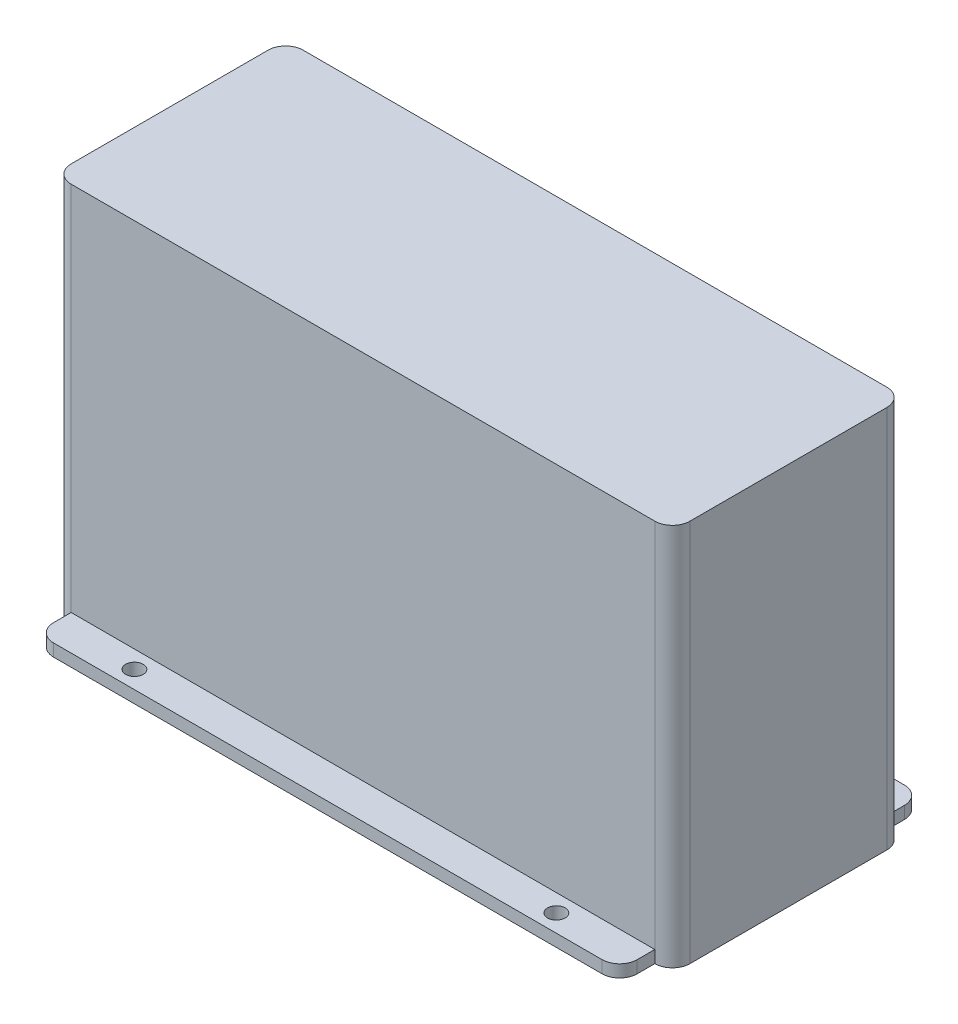
from build123d import *

# Parameters (mm, degrees)
BOSS_EXTRUDE1_DEPTH = 106
BOSS_EXTRUDE2_DEPTH = 3
SKETCH3_R           = 2.5
BOSS_EXTRUDE3_DEPTH = 3.5
CUT_EXTRUDE1_DEPTH  = 16.5
FILLET1_R           = 5


with BuildPart() as part:
    # Sketch1 → Boss-Extrude1 (new body)
    with BuildSketch(Plane(origin=(0, 0, 0), x_dir=(1, 0, 0), z_dir=(0, 1, 0))):
        with BuildLine():
            Line((83, -33), (-83, -33))
            ThreePointArc((-83, -33), (-86.535533906, -31.535533906), (-88, -28))
            Line((-88, -28), (-88, 28))
            ThreePointArc((-88, 28), (-86.535533906, 31.535533906), (-83, 33))
            Line((-83, 33), (83, 33))
            ThreePointArc((83, 33), (86.535533906, 31.535533906), (88, 28))
            Line((88, 28), (88, -28))
            ThreePointArc((88, -28), (86.535533906, -31.535533906), (83, -33))
        make_face()
        with BuildLine():
            Line((80, -30), (-80, -30))
            ThreePointArc((-80, -30), (-83.535533906, -28.535533906), (-85, -25))
            Line((-85, -25), (-85, 25))
            ThreePointArc((-85, 25), (-83.535533906, 28.535533906), (-80, 30))
            Line((-80, 30), (80, 30))
            ThreePointArc((80, 30), (83.535533906, 28.535533906), (85, 25))
            Line((85, 25), (85, -25))
            ThreePointArc((85, -25), (83.535533906, -28.535533906), (80, -30))
        make_face(mode=Mode.SUBTRACT)
    extrude(amount=BOSS_EXTRUDE1_DEPTH)

    # Sketch2 → Boss-Extrude2 (add)
    with BuildSketch(Plane(origin=(0, 106, 0), x_dir=(1, 0, 0), z_dir=(0, 1, 0))):
        with BuildLine():
            Line((-83, 33), (83, 33))
            ThreePointArc((83, 33), (86.535533906, 31.535533906), (88, 28))
            Line((88, 28), (88, -28))
            ThreePointArc((88, -28), (86.535533906, -31.535533906), (83, -33))
            Line((83, -33), (-83, -33))
            ThreePointArc((-83, -33), (-86.535533906, -31.535533906), (-88, -28))
            Line((-88, -28), (-88, 28))
            ThreePointArc((-88, 28), (-86.535533906, 31.535533906), (-83, 33))
        make_face()
    extrude(amount=BOSS_EXTRUDE2_DEPTH)

    # Sketch3 → Boss-Extrude3 (add)
    with BuildSketch(Plane.XZ):
        with BuildLine():
            Line((-83, 33), (83, 33))
            Line((83, 33), (83, 38))
            ThreePointArc((83, 38), (81.535533906, 41.535533906), (78, 43))
            Line((78, 43), (-78, 43))
            ThreePointArc((-78, 43), (-81.535533906, 41.535533906), (-83, 38))
            Line((-83, 38), (-83, 33))
        make_face()
        with Locations(Location((-60, 38, 0), (0, 0, 270))):
            Circle(SKETCH3_R, mode=Mode.SUBTRACT)
        with Locations(Location((60, 38, 0), (0, 0, 90))):
            Circle(SKETCH3_R, mode=Mode.SUBTRACT)
    boss_extrude3 = extrude(amount=-BOSS_EXTRUDE3_DEPTH)

    # Mirror1: Boss-Extrude3 across plane
    add(boss_extrude3.mirror(Plane.XY))

    # Sketch4 → Cut-Extrude1 (cut, symmetric)
    with BuildSketch(Plane(origin=(0, 0, -33), x_dir=(-1, 0, 0), z_dir=(0, 0, -1))):
        with BuildLine():
            Line((47.5, -56), (-47.5, -56))
            Line((-47.5, -56), (-47.5, 51))
            ThreePointArc((-47.5, 51), (-46.035533906, 54.535533906), (-42.5, 56))
            Line((-42.5, 56), (42.5, 56))
            ThreePointArc((42.5, 56), (46.035533906, 54.535533906), (47.5, 51))
            Line((47.5, 51), (47.5, -56))
        make_face()
    extrude(amount=CUT_EXTRUDE1_DEPTH, both=True, mode=Mode.SUBTRACT)

    # Fillet1
    fillet1_edges = [part.edges().sort_by_distance(p)[0] for p in [
        (47.5, 1.75, -43),
        (-47.5, 1.75, -43),
    ]]
    fillet(fillet1_edges, radius=FILLET1_R)


solid = part.part
